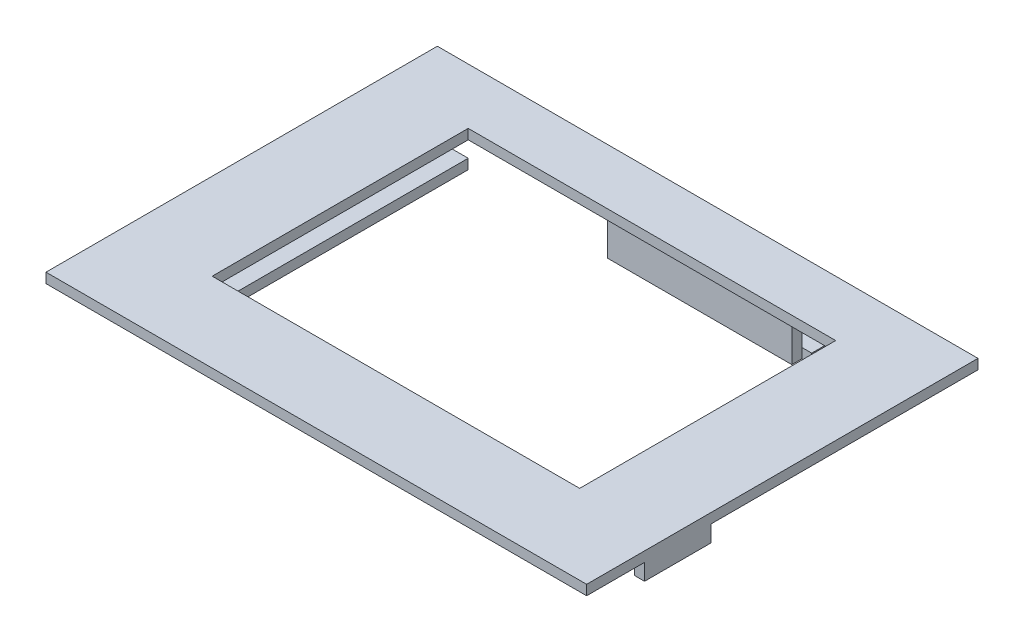
from build123d import *

# Parameters (mm, degrees)
SKETCH1_W            = 54.33
SKETCH1_H            = 39.33
BOSS_EXTRUDE1_DEPTH  = 1
SKETCH2_W            = 6.7
SKETCH2_H            = 1.65
BOSS_EXTRUDE2_DEPTH  = 1
SKETCH3_W            = 20.51
SKETCH3_H            = 4.6
BOSS_EXTRUDE3_DEPTH  = 1
SKETCH5_W            = 50.087359313
SKETCH5_H            = 35.087359313
CUT_EXTRUDE1_DEPTH   = 11
SKETCH6_W            = 18.5
SKETCH6_H            = 7.9
BOSS_EXTRUDE5_DEPTH  = 1
SKETCH7_W            = 20.51
SKETCH7_H            = 1
CUT_EXTRUDE3_DEPTH   = 4.6
SKETCH10_W           = 8
SKETCH10_H           = 1
SKETCH10_W_2         = 5.6
BOSS_EXTRUDE8_DEPTH  = 54.33
SKETCH11_W           = 8.7
SKETCH11_H           = 1
BOSS_EXTRUDE9_DEPTH  = 39.33
SKETCH12_W           = 20.5
SKETCH12_H           = 1
BOSS_EXTRUDE10_DEPTH = 6.25
SKETCH13_W           = 2
SKETCH13_H           = 25.73
BOSS_EXTRUDE14_DEPTH = 2.6
SKETCH16_W           = 25.73
SKETCH16_H           = 1
BOSS_EXTRUDE15_DEPTH = 4
SKETCH17_W           = 25.73
SKETCH17_H           = 1
BOSS_EXTRUDE16_DEPTH = 4


with BuildPart() as part:
    # Sketch1 → Boss-Extrude1 (new body)
    with BuildSketch(Plane(origin=(0, 0, 0), x_dir=(1, 0, 0), z_dir=(0, 1, 0))):
        with Locations((-6.631882129, 3.775979087)):
            Rectangle(SKETCH1_W, SKETCH1_H)
    extrude(amount=BOSS_EXTRUDE1_DEPTH)

    # Sketch2 → Boss-Extrude2 (add)
    with BuildSketch(Plane(origin=(20.533117871, 0, 0), x_dir=(0, 0, -1), z_dir=(1, 0, 0))):
        with Locations((-6.719020913, -0.825)):
            Rectangle(SKETCH2_W, SKETCH2_H)
    extrude(amount=-BOSS_EXTRUDE2_DEPTH)

    # Sketch3 → Boss-Extrude3 (add)
    with BuildSketch(Plane.XY.offset(15.889020913)):
        with Locations((-6.431882129, -2.3)):
            Rectangle(SKETCH3_W, SKETCH3_H)
    extrude(amount=-BOSS_EXTRUDE3_DEPTH)

    # Sketch5 → Cut-Extrude1 (cut)
    with BuildSketch(Plane(origin=(0, 1, 0), x_dir=(1, 0, 0), z_dir=(0, 1, 0))):
        with Locations((-6.63188213, 3.775979088)):
            Rectangle(SKETCH5_W, SKETCH5_H)
    extrude(amount=-CUT_EXTRUDE1_DEPTH, mode=Mode.SUBTRACT)

    # Sketch6 → Boss-Extrude5 (add)
    with BuildSketch(Plane(origin=(0, 0, -23.440979087), x_dir=(-1, 0, 0), z_dir=(0, 0, -1))):
        with Locations((6.426882129, -3.95)):
            Rectangle(SKETCH6_W, SKETCH6_H)
    extrude(amount=-BOSS_EXTRUDE5_DEPTH)

    # Sketch7 → Cut-Extrude3 (cut)
    with BuildSketch(Plane.XZ.offset(4.6)):
        with Locations((-6.431882129, 15.389020913)):
            Rectangle(SKETCH7_W, SKETCH7_H)
    extrude(amount=-CUT_EXTRUDE3_DEPTH, mode=Mode.SUBTRACT)

    # Sketch10 → Boss-Extrude8 (add)
    with BuildSketch(Plane.ZY.offset(33.796882129)):
        with Locations((11.889020913, 0.5)):
            Rectangle(SKETCH10_W, SKETCH10_H)
        with Locations((-20.640979087, 0.5)):
            Rectangle(SKETCH10_W_2, SKETCH10_H)
    extrude(amount=-BOSS_EXTRUDE8_DEPTH)

    # Sketch11 → Boss-Extrude9 (add)
    with BuildSketch(Plane.XY.offset(15.889020913)):
        with Locations((16.183117871, 0.5)):
            Rectangle(SKETCH11_W, SKETCH11_H)
        with Locations((-29.446882129, 0.5)):
            Rectangle(SKETCH11_W, SKETCH11_H)
    extrude(amount=-BOSS_EXTRUDE9_DEPTH)

    # Sketch12 → Boss-Extrude10 (add)
    with BuildSketch(Plane(origin=(0, 0, -23.440979087), x_dir=(-1, 0, 0), z_dir=(0, 0, -1))):
        with Locations((6.426882129, -7.4)):
            Rectangle(SKETCH12_W, SKETCH12_H)
    extrude(amount=BOSS_EXTRUDE10_DEPTH)

    # Sketch13 → Boss-Extrude14 (add)
    with BuildSketch(Plane.XZ):
        with Locations((16.833117871, -4.975979087)):
            Rectangle(SKETCH13_W, SKETCH13_H)
        with Locations((-30.096882129, -4.975979087)):
            Rectangle(SKETCH13_W, SKETCH13_H)
    extrude(amount=BOSS_EXTRUDE14_DEPTH)

    # Sketch16 → Boss-Extrude15 (add)
    with BuildSketch(Plane.ZY.offset(-15.833117871)):
        with Locations((-4.975979087, -2.1)):
            Rectangle(SKETCH16_W, SKETCH16_H)
    extrude(amount=BOSS_EXTRUDE15_DEPTH)

    # Sketch17 → Boss-Extrude16 (add)
    with BuildSketch(Plane(origin=(-29.096882129, 0, 0), x_dir=(0, 0, -1), z_dir=(1, 0, 0))):
        with Locations((4.975979087, -2.1)):
            Rectangle(SKETCH17_W, SKETCH17_H)
    extrude(amount=BOSS_EXTRUDE16_DEPTH)


solid = part.part
